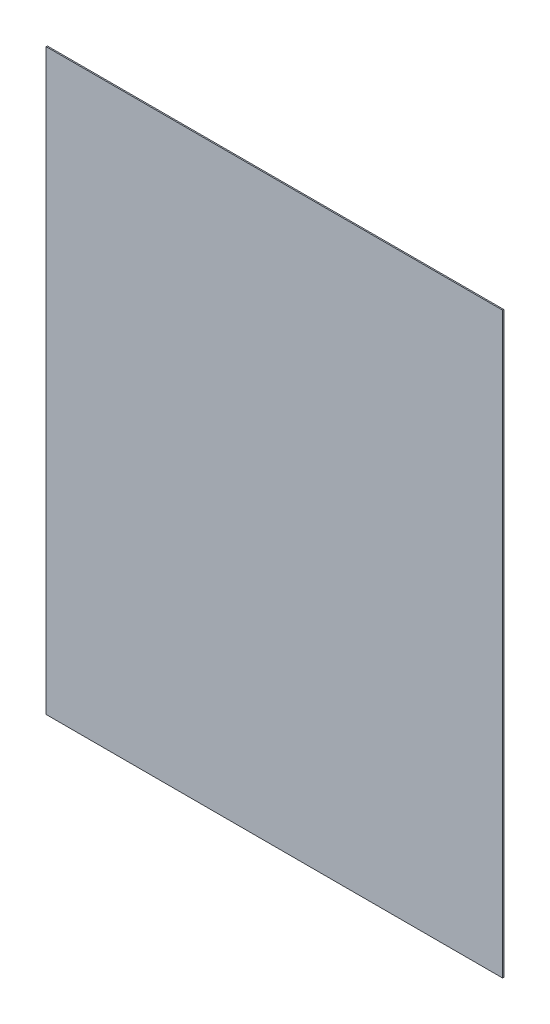
from build123d import *

# Parameters (mm, degrees)
CROQUIS1_W              = 710
CROQUIS1_H              = 900
SALIENTE_EXTRUIR1_DEPTH = 1.9


with BuildPart() as part:
    # Croquis1 → Saliente-Extruir1 (new body)
    with BuildSketch(Plane.XY):
        Rectangle(CROQUIS1_W, CROQUIS1_H)
    extrude(amount=SALIENTE_EXTRUIR1_DEPTH)


solid = part.part
